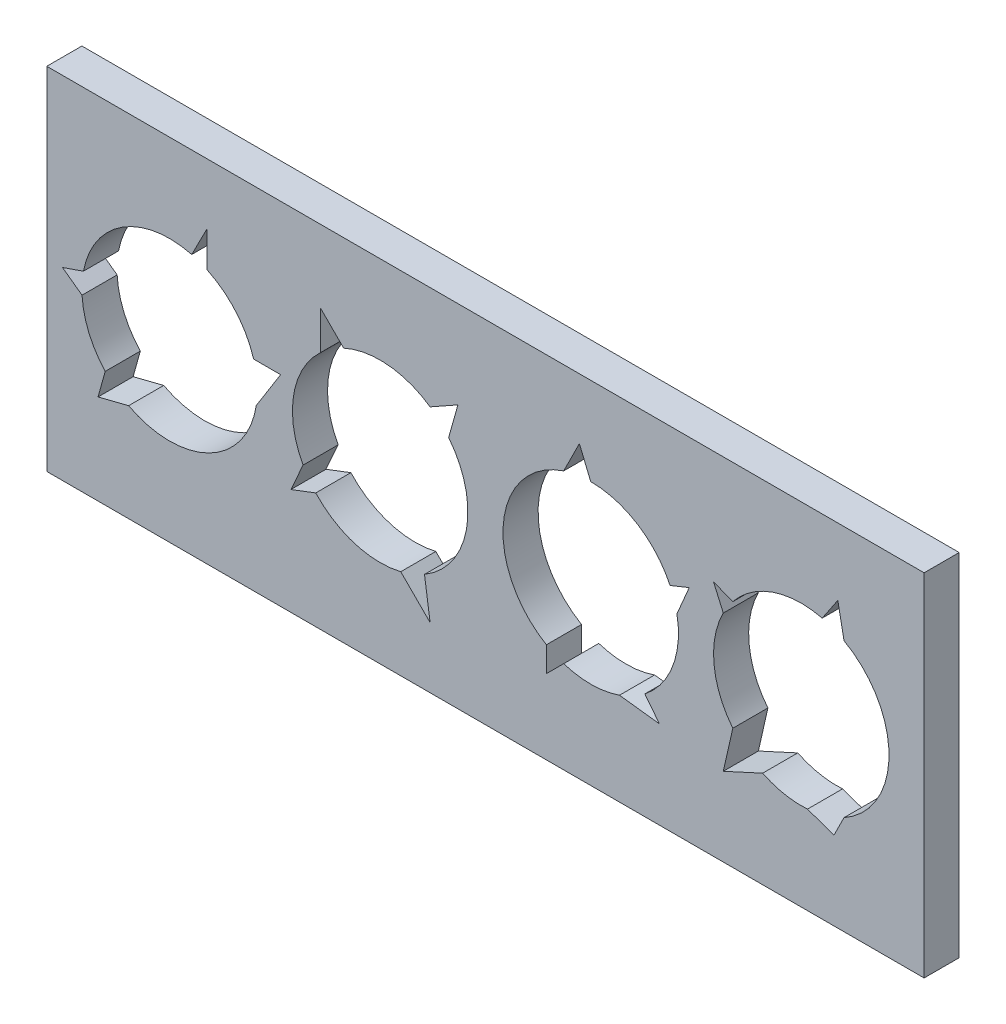
from build123d import *

# Parameters (mm, degrees)
BOSS_EXTRUDE2_DEPTH = 10


with BuildPart() as part:
    # Sketch1 → Boss-Extrude2 (new body)
    with BuildSketch(Plane.XY):
        with BuildLine():
            Line((-49.595588235, 30.790441176), (-49.595588235, 55.790441176))
            Line((-49.595588235, 55.790441176), (-84.595588235, 55.790441176))
            Line((-84.595588235, 55.790441176), (-84.595588235, 5.790441176))
            Line((-84.595588235, 5.790441176), (-76.571127836, 5.790441176))
            Line((-76.571127836, 5.790441176), (-80.122995865, 8.369201143))
            Line((-80.122995865, 8.369201143), (-74.161024923, 10.431488509))
            ThreePointArc((-74.161024923, 10.431488509), (-65.548234046, 25.0391578), (-49.595588235, 30.790441176))
        make_face()
        with BuildLine():
            Line((10.404411765, 55.790441176), (-49.595588235, 55.790441176))
            Line((-49.595588235, 55.790441176), (-49.595588235, 30.790441176))
            ThreePointArc((-49.595588235, 30.790441176), (-46.420318597, 30.587974576), (-43.296479842, 29.983854194))
            Line((-43.296479842, 29.983854194), (-38.907655076, 38.5487403))
            Line((-38.907655076, 38.5487403), (-38.907655076, 28.390620042))
            ThreePointArc((-38.907655076, 28.390620042), (-30.648795615, 22.100531594), (-25.657089919, 12.997957973))
            Line((-25.657089919, 12.997957973), (-17.962154019, 12.997957973))
            Line((-17.962154019, 12.997957973), (-22.478851702, 5.790441176))
            Line((-22.478851702, 5.790441176), (-14.595588235, 5.790441176))
            ThreePointArc((-14.595588235, 5.790441176), (-12.499276658, 15.811471895), (-6.561903703, 24.151926396))
            Line((-6.561903703, 24.151926396), (-6.561903703, 35.084441479))
            Line((-6.561903703, 35.084441479), (0, 28.522537776))
            ThreePointArc((0, 28.522537776), (5.080053353, 30.216886016), (10.404411765, 30.790441176))
            Line((10.404411765, 30.790441176), (10.404411765, 55.790441176))
        make_face()
        with BuildLine():
            Line((70.404411765, 55.790441176), (10.404411765, 55.790441176))
            Line((10.404411765, 55.790441176), (10.404411765, 30.790441176))
            ThreePointArc((10.404411765, 30.790441176), (17.859813508, 29.652900917), (24.63674968, 26.343799964))
            Line((24.63674968, 26.343799964), (32.552494412, 30.790441176))
            Line((32.552494412, 30.790441176), (29.92126971, 21.41389329))
            ThreePointArc((29.92126971, 21.41389329), (33.993831518, 14.069286246), (35.404411765, 5.790441176))
            Line((35.404411765, 5.790441176), (45.404411765, 5.790441176))
            ThreePointArc((45.404411765, 5.790441176), (50.185133178, 20.493528384), (62.698873639, 29.573306483))
            Line((62.698873639, 29.573306483), (67.171172857, 38.5487403))
            Line((67.171172857, 38.5487403), (70.404411765, 30.790441176))
            Line((70.404411765, 30.790441176), (70.404411765, 55.790441176))
        make_face()
        with BuildLine():
            Line((130.404411765, 55.790441176), (70.404411765, 55.790441176))
            Line((70.404411765, 55.790441176), (70.404411765, 30.790441176))
            ThreePointArc((70.404411765, 30.790441176), (83.787720088, 26.906479118), (93.012607471, 16.461405843))
            Line((93.012607471, 16.461405843), (98.474145882, 18.660683713))
            Line((98.474145882, 18.660683713), (94.969848452, 10.431488509))
            ThreePointArc((94.969848452, 10.431488509), (95.295533849, 8.1211152), (95.404411765, 5.790441176))
            Line((95.404411765, 5.790441176), (105.404411765, 5.790441176))
            ThreePointArc((105.404411765, 5.790441176), (106.107781477, 11.678883811), (108.178312298, 17.23598627))
            Line((108.178312298, 17.23598627), (105.404411765, 23.549684511))
            Line((105.404411765, 23.549684511), (110.88755382, 21.41389329))
            ThreePointArc((110.88755382, 21.41389329), (119.578200582, 28.324707338), (130.404411765, 30.790441176))
            Line((130.404411765, 30.790441176), (130.404411765, 55.790441176))
        make_face()
        with BuildLine():
            Line((165.404411765, 55.790441176), (130.404411765, 55.790441176))
            Line((130.404411765, 55.790441176), (130.404411765, 30.790441176))
            ThreePointArc((130.404411765, 30.790441176), (133.401752606, 30.610109746), (136.355852267, 30.071717007))
            Line((136.355852267, 30.071717007), (140.818257218, 36.687543597))
            Line((140.818257218, 36.687543597), (142.579811014, 27.625267787))
            ThreePointArc((142.579811014, 27.625267787), (151.961139035, 18.451701358), (155.404411765, 5.790441176))
            Line((155.404411765, 5.790441176), (165.404411765, 5.790441176))
            Line((165.404411765, 5.790441176), (165.404411765, 55.790441176))
        make_face()
        with BuildLine():
            Line((165.404411765, -44.209558824), (165.404411765, 5.790441176))
            Line((165.404411765, 5.790441176), (155.404411765, 5.790441176))
            ThreePointArc((155.404411765, 5.790441176), (151.961139035, -6.870819005), (142.579811014, -16.044385434))
            Line((142.579811014, -16.044385434), (139.723435627, -21.807209952))
            Line((139.723435627, -21.807209952), (132.176529952, -19.14667167))
            ThreePointArc((132.176529952, -19.14667167), (131.291028602, -19.193832089), (130.404411765, -19.209558824))
            Line((130.404411765, -19.209558824), (130.404411765, -44.209558824))
            Line((130.404411765, -44.209558824), (165.404411765, -44.209558824))
        make_face()
        with BuildLine():
            ThreePointArc((78.603951233, -17.826661789), (74.562080934, -18.861410419), (70.404411765, -19.209558824))
            Line((70.404411765, -19.209558824), (70.404411765, -44.209558824))
            Line((70.404411765, -44.209558824), (130.404411765, -44.209558824))
            Line((130.404411765, -44.209558824), (130.404411765, -19.209558824))
            ThreePointArc((130.404411765, -19.209558824), (124.758153779, -18.563609221), (119.403671642, -16.659140484))
            Line((119.403671642, -16.659140484), (108.178312298, -21.807209952))
            Line((108.178312298, -21.807209952), (110.88755382, -9.833010937))
            ThreePointArc((110.88755382, -9.833010937), (106.814992011, -2.488403893), (105.404411765, 5.790441176))
            Line((105.404411765, 5.790441176), (95.404411765, 5.790441176))
            ThreePointArc((95.404411765, 5.790441176), (92.88136777, -5.154258396), (85.821495865, -13.889841287))
            Line((85.821495865, -13.889841287), (89.988841167, -19.209558824))
            Line((89.988841167, -19.209558824), (78.603951233, -17.826661789))
        make_face()
        with BuildLine():
            ThreePointArc((16.26584722, -18.512718585), (13.35576789, -19.034737514), (10.404411765, -19.209558824))
            Line((10.404411765, -19.209558824), (10.404411765, -44.209558824))
            Line((10.404411765, -44.209558824), (70.404411765, -44.209558824))
            Line((70.404411765, -44.209558824), (70.404411765, -19.209558824))
            ThreePointArc((70.404411765, -19.209558824), (66.503875434, -18.903400492), (62.698873639, -17.99242413))
            Line((62.698873639, -17.99242413), (57.774840306, -22.916457463))
            Line((57.774840306, -22.916457463), (57.774840306, -15.784867043))
            ThreePointArc((57.774840306, -15.784867043), (48.716404866, -6.644604331), (45.404411765, 5.790441176))
            Line((45.404411765, 5.790441176), (35.404411765, 5.790441176))
            ThreePointArc((35.404411765, 5.790441176), (32.092418663, -6.644604331), (23.033983223, -15.784867043))
            Line((23.033983223, -15.784867043), (24.63674968, -26.883621045))
            Line((24.63674968, -26.883621045), (16.26584722, -18.512718585))
        make_face()
        with BuildLine():
            ThreePointArc((-24.894580949, 1.935543121), (-33.337858557, -13.20129981), (-49.595588235, -19.209558824))
            Line((-49.595588235, -19.209558824), (-49.595588235, -44.209558824))
            Line((-49.595588235, -44.209558824), (10.404411765, -44.209558824))
            Line((10.404411765, -44.209558824), (10.404411765, -19.209558824))
            ThreePointArc((10.404411765, -19.209558824), (0.386918535, -17.114794674), (-7.951831841, -11.181545175))
            Line((-7.951831841, -11.181545175), (-15.042390882, -13.889841287))
            Line((-15.042390882, -13.889841287), (-11.571398063, -6.128610062))
            ThreePointArc((-11.571398063, -6.128610062), (-13.827749155, -0.357922603), (-14.595588235, 5.790441176))
            Line((-14.595588235, 5.790441176), (-22.478851702, 5.790441176))
            Line((-22.478851702, 5.790441176), (-24.894580949, 1.935543121))
        make_face()
        with BuildLine():
            Line((-76.571127836, 5.790441176), (-84.595588235, 5.790441176))
            Line((-84.595588235, 5.790441176), (-84.595588235, -44.209558824))
            Line((-84.595588235, -44.209558824), (-49.595588235, -44.209558824))
            Line((-49.595588235, -44.209558824), (-49.595588235, -19.209558824))
            ThreePointArc((-49.595588235, -19.209558824), (-55.612209406, -18.474765802), (-61.275152877, -16.313580398))
            Line((-61.275152877, -16.313580398), (-69.988075999, -18.512718585))
            Line((-69.988075999, -18.512718585), (-67.951831841, -11.181545175))
            ThreePointArc((-67.951831841, -11.181545175), (-72.598243173, -4.001283177), (-74.552596729, 4.324928615))
            Line((-74.552596729, 4.324928615), (-76.571127836, 5.790441176))
        make_face()
    extrude(amount=BOSS_EXTRUDE2_DEPTH)


solid = part.part
